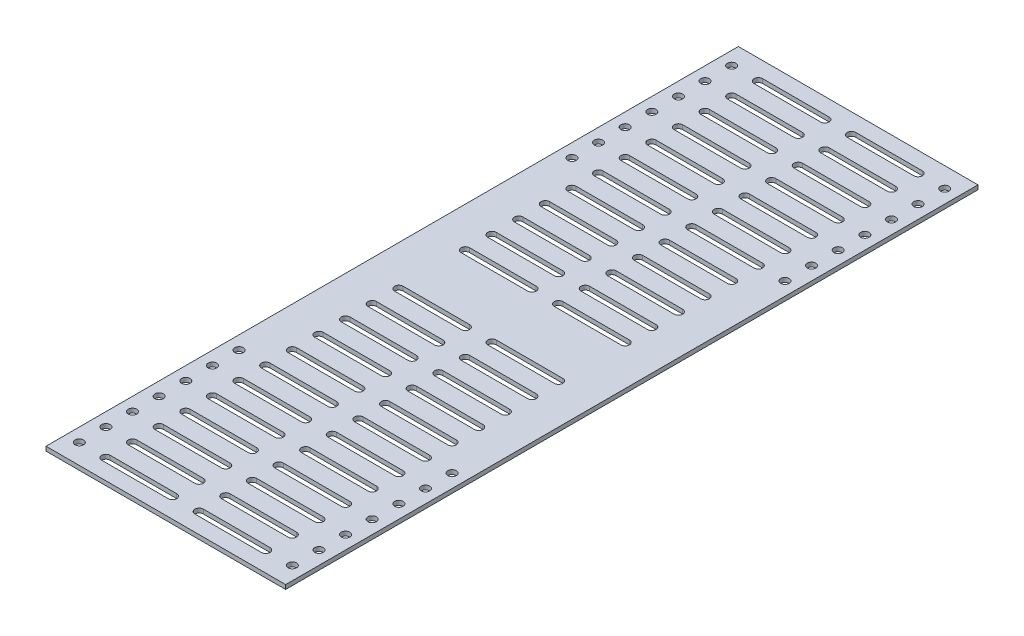
from build123d import *

# Parameters (mm, degrees)
SKETCH1_W           = 90
SKETCH1_H           = 260
BOSS_EXTRUDE1_DEPTH = 1.6
SKETCH2_R           = 1.6
CUT_EXTRUDE1_DEPTH  = 276.140982044
CUT_EXTRUDE2_DEPTH  = 10


with BuildPart() as part:
    # Sketch1 → Boss-Extrude1 (new body)
    with BuildSketch(Plane(origin=(0, 0, 0), x_dir=(1, 0, 0), z_dir=(0, 1, 0))):
        with Locations((45, 130)):
            Rectangle(SKETCH1_W, SKETCH1_H)
    extrude(amount=BOSS_EXTRUDE1_DEPTH)

    # Sketch2 → Cut-Extrude1 (cut, through all)
    with BuildSketch(Plane(origin=(0, 1.6, 0), x_dir=(1, 0, 0), z_dir=(0, 1, 0))):
        with Locations(Location((5, 252.5, 0), (0, 0, 270))):
            Circle(SKETCH2_R)
        with Locations(Location((85, 252.5, 0), (0, 0, 270))):
            Circle(SKETCH2_R)
        with Locations(Location((85, 242.5, 0), (0, 0, 270))):
            Circle(SKETCH2_R)
        with Locations(Location((85, 232.5, 0), (0, 0, 270))):
            Circle(SKETCH2_R)
        with Locations(Location((85, 222.5, 0), (0, 0, 270))):
            Circle(SKETCH2_R)
        with Locations(Location((85, 212.5, 0), (0, 0, 270))):
            Circle(SKETCH2_R)
        with Locations(Location((85, 202.5, 0), (0, 0, 270))):
            Circle(SKETCH2_R)
        with Locations(Location((5, 242.5, 0), (0, 0, 270))):
            Circle(SKETCH2_R)
        with Locations(Location((5, 232.5, 0), (0, 0, 270))):
            Circle(SKETCH2_R)
        with Locations(Location((5, 222.5, 0), (0, 0, 270))):
            Circle(SKETCH2_R)
        with Locations(Location((5, 212.5, 0), (0, 0, 270))):
            Circle(SKETCH2_R)
        with Locations(Location((5, 202.5, 0), (0, 0, 270))):
            Circle(SKETCH2_R)
        with Locations(Location((5, 192.5, 0), (0, 0, 270))):
            Circle(SKETCH2_R)
        with Locations(Location((85, 192.5, 0), (0, 0, 270))):
            Circle(SKETCH2_R)
        with Locations(Location((85, 67.5, 0), (0, 0, 90))):
            Circle(SKETCH2_R)
        with Locations(Location((5, 67.5, 0), (0, 0, 90))):
            Circle(SKETCH2_R)
        with Locations(Location((5, 57.5, 0), (0, 0, 90))):
            Circle(SKETCH2_R)
        with Locations(Location((5, 47.5, 0), (0, 0, 90))):
            Circle(SKETCH2_R)
        with Locations(Location((5, 37.5, 0), (0, 0, 90))):
            Circle(SKETCH2_R)
        with Locations(Location((5, 27.5, 0), (0, 0, 90))):
            Circle(SKETCH2_R)
        with Locations(Location((5, 17.5, 0), (0, 0, 90))):
            Circle(SKETCH2_R)
        with Locations(Location((85, 57.5, 0), (0, 0, 90))):
            Circle(SKETCH2_R)
        with Locations(Location((85, 47.5, 0), (0, 0, 90))):
            Circle(SKETCH2_R)
        with Locations(Location((85, 37.5, 0), (0, 0, 90))):
            Circle(SKETCH2_R)
        with Locations(Location((85, 27.5, 0), (0, 0, 90))):
            Circle(SKETCH2_R)
        with Locations(Location((85, 17.5, 0), (0, 0, 90))):
            Circle(SKETCH2_R)
        with Locations(Location((85, 7.5, 0), (0, 0, 90))):
            Circle(SKETCH2_R)
        with Locations(Location((5, 7.5, 0), (0, 0, 90))):
            Circle(SKETCH2_R)
    extrude(amount=-CUT_EXTRUDE1_DEPTH, mode=Mode.SUBTRACT)

    # Sketch3 → Cut-Extrude2 (cut)
    with BuildSketch(Plane(origin=(0, 1.6, 0), x_dir=(1, 0, 0), z_dir=(0, 1, 0))):
        with BuildLine():
            Line((15, 254.1), (40, 254.1))
            ThreePointArc((40, 254.1), (41.6, 252.5), (40, 250.9))
            Line((40, 250.9), (15, 250.9))
            ThreePointArc((15, 250.9), (13.4, 252.5), (15, 254.1))
        make_face()
        with BuildLine():
            Line((15, 244.1), (40, 244.1))
            ThreePointArc((40, 244.1), (41.6, 242.5), (40, 240.9))
            Line((40, 240.9), (15, 240.9))
            ThreePointArc((15, 240.9), (13.4, 242.5), (15, 244.1))
        make_face()
        with BuildLine():
            Line((15, 234.1), (40, 234.1))
            ThreePointArc((40, 234.1), (41.6, 232.5), (40, 230.9))
            Line((40, 230.9), (15, 230.9))
            ThreePointArc((15, 230.9), (13.4, 232.5), (15, 234.1))
        make_face()
        with BuildLine():
            Line((15, 224.1), (40, 224.1))
            ThreePointArc((40, 224.1), (41.6, 222.5), (40, 220.9))
            Line((40, 220.9), (15, 220.9))
            ThreePointArc((15, 220.9), (13.4, 222.5), (15, 224.1))
        make_face()
        with BuildLine():
            Line((15, 214.1), (40, 214.1))
            ThreePointArc((40, 214.1), (41.6, 212.5), (40, 210.9))
            Line((40, 210.9), (15, 210.9))
            ThreePointArc((15, 210.9), (13.4, 212.5), (15, 214.1))
        make_face()
        with BuildLine():
            Line((15, 204.1), (40, 204.1))
            ThreePointArc((40, 204.1), (41.6, 202.5), (40, 200.9))
            Line((40, 200.9), (15, 200.9))
            ThreePointArc((15, 200.9), (13.4, 202.5), (15, 204.1))
        make_face()
        with BuildLine():
            Line((15, 194.1), (40, 194.1))
            ThreePointArc((40, 194.1), (41.6, 192.5), (40, 190.9))
            Line((40, 190.9), (15, 190.9))
            ThreePointArc((15, 190.9), (13.4, 192.5), (15, 194.1))
        make_face()
        with BuildLine():
            Line((15, 184.1), (40, 184.1))
            ThreePointArc((40, 184.1), (41.6, 182.5), (40, 180.9))
            Line((40, 180.9), (15, 180.9))
            ThreePointArc((15, 180.9), (13.4, 182.5), (15, 184.1))
        make_face()
        with BuildLine():
            Line((15, 174.1), (40, 174.1))
            ThreePointArc((40, 174.1), (41.6, 172.5), (40, 170.9))
            Line((40, 170.9), (15, 170.9))
            ThreePointArc((15, 170.9), (13.4, 172.5), (15, 174.1))
        make_face()
        with BuildLine():
            Line((15, 164.1), (40, 164.1))
            ThreePointArc((40, 164.1), (41.6, 162.5), (40, 160.9))
            Line((40, 160.9), (15, 160.9))
            ThreePointArc((15, 160.9), (13.4, 162.5), (15, 164.1))
        make_face()
        with BuildLine():
            Line((15, 154.1), (40, 154.1))
            ThreePointArc((40, 154.1), (41.6, 152.5), (40, 150.9))
            Line((40, 150.9), (15, 150.9))
            ThreePointArc((15, 150.9), (13.4, 152.5), (15, 154.1))
        make_face()
        with BuildLine():
            Line((15, 144.1), (40, 144.1))
            ThreePointArc((40, 144.1), (41.6, 142.5), (40, 140.9))
            Line((40, 140.9), (15, 140.9))
            ThreePointArc((15, 140.9), (13.4, 142.5), (15, 144.1))
        make_face()
        with BuildLine():
            Line((15, 5.9), (40, 5.9))
            ThreePointArc((40, 5.9), (41.6, 7.5), (40, 9.1))
            Line((40, 9.1), (15, 9.1))
            ThreePointArc((15, 9.1), (13.4, 7.5), (15, 5.9))
        make_face()
        with BuildLine():
            Line((15, 15.9), (40, 15.9))
            ThreePointArc((40, 15.9), (41.6, 17.5), (40, 19.1))
            Line((40, 19.1), (15, 19.1))
            ThreePointArc((15, 19.1), (13.4, 17.5), (15, 15.9))
        make_face()
        with BuildLine():
            Line((15, 25.9), (40, 25.9))
            ThreePointArc((40, 25.9), (41.6, 27.5), (40, 29.1))
            Line((40, 29.1), (15, 29.1))
            ThreePointArc((15, 29.1), (13.4, 27.5), (15, 25.9))
        make_face()
        with BuildLine():
            Line((15, 35.9), (40, 35.9))
            ThreePointArc((40, 35.9), (41.6, 37.5), (40, 39.1))
            Line((40, 39.1), (15, 39.1))
            ThreePointArc((15, 39.1), (13.4, 37.5), (15, 35.9))
        make_face()
        with BuildLine():
            Line((15, 45.9), (40, 45.9))
            ThreePointArc((40, 45.9), (41.6, 47.5), (40, 49.1))
            Line((40, 49.1), (15, 49.1))
            ThreePointArc((15, 49.1), (13.4, 47.5), (15, 45.9))
        make_face()
        with BuildLine():
            Line((15, 55.9), (40, 55.9))
            ThreePointArc((40, 55.9), (41.6, 57.5), (40, 59.1))
            Line((40, 59.1), (15, 59.1))
            ThreePointArc((15, 59.1), (13.4, 57.5), (15, 55.9))
        make_face()
        with BuildLine():
            Line((15, 65.9), (40, 65.9))
            ThreePointArc((40, 65.9), (41.6, 67.5), (40, 69.1))
            Line((40, 69.1), (15, 69.1))
            ThreePointArc((15, 69.1), (13.4, 67.5), (15, 65.9))
        make_face()
        with BuildLine():
            Line((15, 75.9), (40, 75.9))
            ThreePointArc((40, 75.9), (41.6, 77.5), (40, 79.1))
            Line((40, 79.1), (15, 79.1))
            ThreePointArc((15, 79.1), (13.4, 77.5), (15, 75.9))
        make_face()
        with BuildLine():
            Line((15, 85.9), (40, 85.9))
            ThreePointArc((40, 85.9), (41.6, 87.5), (40, 89.1))
            Line((40, 89.1), (15, 89.1))
            ThreePointArc((15, 89.1), (13.4, 87.5), (15, 85.9))
        make_face()
        with BuildLine():
            Line((15, 95.9), (40, 95.9))
            ThreePointArc((40, 95.9), (41.6, 97.5), (40, 99.1))
            Line((40, 99.1), (15, 99.1))
            ThreePointArc((15, 99.1), (13.4, 97.5), (15, 95.9))
        make_face()
        with BuildLine():
            Line((15, 105.9), (40, 105.9))
            ThreePointArc((40, 105.9), (41.6, 107.5), (40, 109.1))
            Line((40, 109.1), (15, 109.1))
            ThreePointArc((15, 109.1), (13.4, 107.5), (15, 105.9))
        make_face()
        with BuildLine():
            Line((15, 115.9), (40, 115.9))
            ThreePointArc((40, 115.9), (41.6, 117.5), (40, 119.1))
            Line((40, 119.1), (15, 119.1))
            ThreePointArc((15, 119.1), (13.4, 117.5), (15, 115.9))
        make_face()
        with BuildLine():
            Line((75, 254.1), (50, 254.1))
            ThreePointArc((50, 254.1), (48.4, 252.5), (50, 250.9))
            Line((50, 250.9), (75, 250.9))
            ThreePointArc((75, 250.9), (76.6, 252.5), (75, 254.1))
        make_face()
        with BuildLine():
            Line((75, 244.1), (50, 244.1))
            ThreePointArc((50, 244.1), (48.4, 242.5), (50, 240.9))
            Line((50, 240.9), (75, 240.9))
            ThreePointArc((75, 240.9), (76.6, 242.5), (75, 244.1))
        make_face()
        with BuildLine():
            Line((75, 234.1), (50, 234.1))
            ThreePointArc((50, 234.1), (48.4, 232.5), (50, 230.9))
            Line((50, 230.9), (75, 230.9))
            ThreePointArc((75, 230.9), (76.6, 232.5), (75, 234.1))
        make_face()
        with BuildLine():
            Line((75, 224.1), (50, 224.1))
            ThreePointArc((50, 224.1), (48.4, 222.5), (50, 220.9))
            Line((50, 220.9), (75, 220.9))
            ThreePointArc((75, 220.9), (76.6, 222.5), (75, 224.1))
        make_face()
        with BuildLine():
            Line((75, 214.1), (50, 214.1))
            ThreePointArc((50, 214.1), (48.4, 212.5), (50, 210.9))
            Line((50, 210.9), (75, 210.9))
            ThreePointArc((75, 210.9), (76.6, 212.5), (75, 214.1))
        make_face()
        with BuildLine():
            Line((75, 204.1), (50, 204.1))
            ThreePointArc((50, 204.1), (48.4, 202.5), (50, 200.9))
            Line((50, 200.9), (75, 200.9))
            ThreePointArc((75, 200.9), (76.6, 202.5), (75, 204.1))
        make_face()
        with BuildLine():
            Line((75, 194.1), (50, 194.1))
            ThreePointArc((50, 194.1), (48.4, 192.5), (50, 190.9))
            Line((50, 190.9), (75, 190.9))
            ThreePointArc((75, 190.9), (76.6, 192.5), (75, 194.1))
        make_face()
        with BuildLine():
            Line((75, 184.1), (50, 184.1))
            ThreePointArc((50, 184.1), (48.4, 182.5), (50, 180.9))
            Line((50, 180.9), (75, 180.9))
            ThreePointArc((75, 180.9), (76.6, 182.5), (75, 184.1))
        make_face()
        with BuildLine():
            Line((75, 174.1), (50, 174.1))
            ThreePointArc((50, 174.1), (48.4, 172.5), (50, 170.9))
            Line((50, 170.9), (75, 170.9))
            ThreePointArc((75, 170.9), (76.6, 172.5), (75, 174.1))
        make_face()
        with BuildLine():
            Line((75, 164.1), (50, 164.1))
            ThreePointArc((50, 164.1), (48.4, 162.5), (50, 160.9))
            Line((50, 160.9), (75, 160.9))
            ThreePointArc((75, 160.9), (76.6, 162.5), (75, 164.1))
        make_face()
        with BuildLine():
            Line((75, 154.1), (50, 154.1))
            ThreePointArc((50, 154.1), (48.4, 152.5), (50, 150.9))
            Line((50, 150.9), (75, 150.9))
            ThreePointArc((75, 150.9), (76.6, 152.5), (75, 154.1))
        make_face()
        with BuildLine():
            Line((75, 144.1), (50, 144.1))
            ThreePointArc((50, 144.1), (48.4, 142.5), (50, 140.9))
            Line((50, 140.9), (75, 140.9))
            ThreePointArc((75, 140.9), (76.6, 142.5), (75, 144.1))
        make_face()
        with BuildLine():
            Line((75, 5.9), (50, 5.9))
            ThreePointArc((50, 5.9), (48.4, 7.5), (50, 9.1))
            Line((50, 9.1), (75, 9.1))
            ThreePointArc((75, 9.1), (76.6, 7.5), (75, 5.9))
        make_face()
        with BuildLine():
            Line((75, 15.9), (50, 15.9))
            ThreePointArc((50, 15.9), (48.4, 17.5), (50, 19.1))
            Line((50, 19.1), (75, 19.1))
            ThreePointArc((75, 19.1), (76.6, 17.5), (75, 15.9))
        make_face()
        with BuildLine():
            Line((75, 25.9), (50, 25.9))
            ThreePointArc((50, 25.9), (48.4, 27.5), (50, 29.1))
            Line((50, 29.1), (75, 29.1))
            ThreePointArc((75, 29.1), (76.6, 27.5), (75, 25.9))
        make_face()
        with BuildLine():
            Line((75, 35.9), (50, 35.9))
            ThreePointArc((50, 35.9), (48.4, 37.5), (50, 39.1))
            Line((50, 39.1), (75, 39.1))
            ThreePointArc((75, 39.1), (76.6, 37.5), (75, 35.9))
        make_face()
        with BuildLine():
            Line((75, 45.9), (50, 45.9))
            ThreePointArc((50, 45.9), (48.4, 47.5), (50, 49.1))
            Line((50, 49.1), (75, 49.1))
            ThreePointArc((75, 49.1), (76.6, 47.5), (75, 45.9))
        make_face()
        with BuildLine():
            Line((75, 55.9), (50, 55.9))
            ThreePointArc((50, 55.9), (48.4, 57.5), (50, 59.1))
            Line((50, 59.1), (75, 59.1))
            ThreePointArc((75, 59.1), (76.6, 57.5), (75, 55.9))
        make_face()
        with BuildLine():
            Line((75, 65.9), (50, 65.9))
            ThreePointArc((50, 65.9), (48.4, 67.5), (50, 69.1))
            Line((50, 69.1), (75, 69.1))
            ThreePointArc((75, 69.1), (76.6, 67.5), (75, 65.9))
        make_face()
        with BuildLine():
            Line((75, 75.9), (50, 75.9))
            ThreePointArc((50, 75.9), (48.4, 77.5), (50, 79.1))
            Line((50, 79.1), (75, 79.1))
            ThreePointArc((75, 79.1), (76.6, 77.5), (75, 75.9))
        make_face()
        with BuildLine():
            Line((75, 85.9), (50, 85.9))
            ThreePointArc((50, 85.9), (48.4, 87.5), (50, 89.1))
            Line((50, 89.1), (75, 89.1))
            ThreePointArc((75, 89.1), (76.6, 87.5), (75, 85.9))
        make_face()
        with BuildLine():
            Line((75, 95.9), (50, 95.9))
            ThreePointArc((50, 95.9), (48.4, 97.5), (50, 99.1))
            Line((50, 99.1), (75, 99.1))
            ThreePointArc((75, 99.1), (76.6, 97.5), (75, 95.9))
        make_face()
        with BuildLine():
            Line((75, 105.9), (50, 105.9))
            ThreePointArc((50, 105.9), (48.4, 107.5), (50, 109.1))
            Line((50, 109.1), (75, 109.1))
            ThreePointArc((75, 109.1), (76.6, 107.5), (75, 105.9))
        make_face()
        with BuildLine():
            Line((75, 115.9), (50, 115.9))
            ThreePointArc((50, 115.9), (48.4, 117.5), (50, 119.1))
            Line((50, 119.1), (75, 119.1))
            ThreePointArc((75, 119.1), (76.6, 117.5), (75, 115.9))
        make_face()
    extrude(amount=-CUT_EXTRUDE2_DEPTH, mode=Mode.SUBTRACT)


solid = part.part
